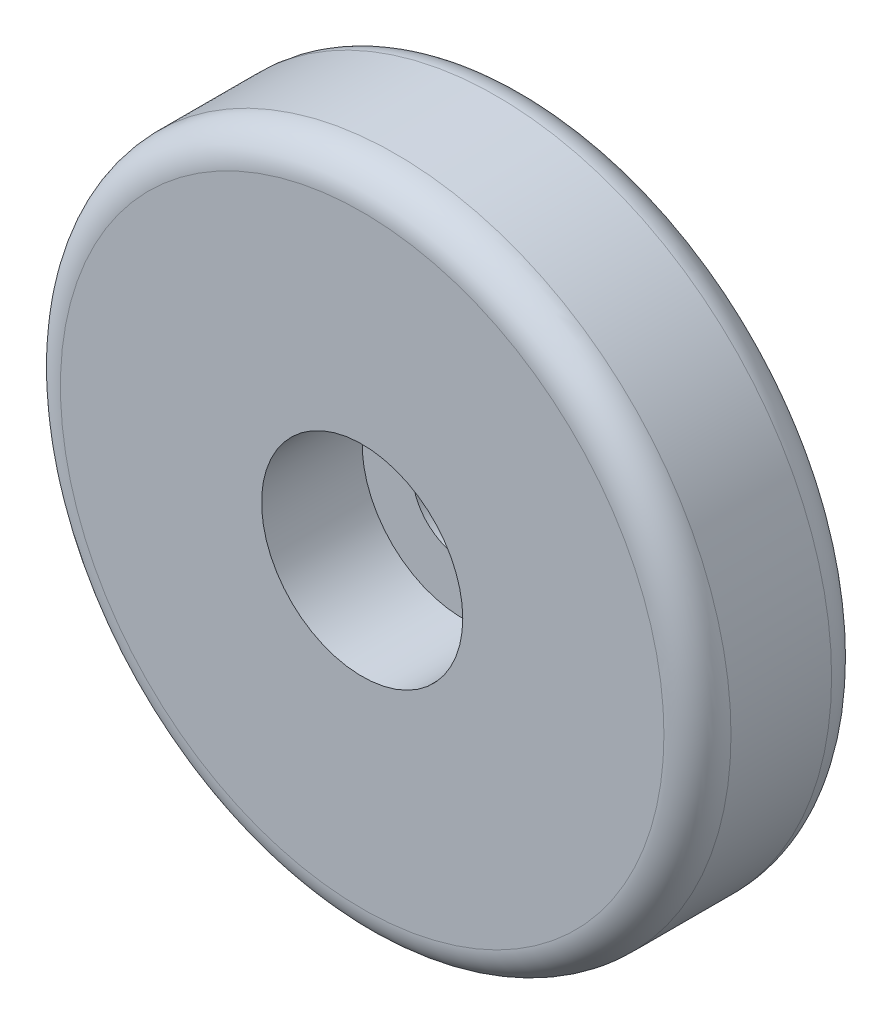
from build123d import *

# Parameters (mm, degrees)
ESQUISSE1_R             = 10
BOSS_EXTRU_1_DEPTH      = 5
ESQUISSE2_R             = 3
ENL_V_MAT_EXTRU_1_DEPTH = 3
ESQUISSE9_R             = 1.5
ENL_V_MAT_EXTRU_2_DEPTH = 3


with BuildPart() as part:
    # Esquisse1 → Boss.-Extru.1 (new body)
    with BuildSketch(Plane.XY):
        Circle(ESQUISSE1_R)
    extrude(amount=BOSS_EXTRU_1_DEPTH)

    # Esquisse2 → Enlèv. mat.-Extru.1 (cut)
    with BuildSketch(Plane.XY.offset(5)):
        Circle(ESQUISSE2_R)
    extrude(amount=-ENL_V_MAT_EXTRU_1_DEPTH, mode=Mode.SUBTRACT)

    # Esquisse3 → Enlèvement de matière-Révolution1 (revolve, cut)
    with BuildSketch(Plane(origin=(0, 0, 0), x_dir=(0, 0, -1), z_dir=(1, 0, 0)), mode=Mode.PRIVATE) as enl_vement_de_mati_re_r_volution1_sk:
        with BuildLine():
            Line((0, 10), (-1, 10))
            ThreePointArc((-1, 10), (-0.292893219, 9.707106781), (0, 9))
            Line((0, 9), (0, 10))
        make_face()
        with BuildLine():
            Line((-4, 10), (-5, 10))
            Line((-5, 10), (-5, 9))
            ThreePointArc((-5, 9), (-4.707106781, 9.707106781), (-4, 10))
        make_face()
    revolve(enl_vement_de_mati_re_r_volution1_sk.sketch.rotate(Axis((0, 0, 5), (0, 0, -1)), 90), axis=Axis((0, 0, 5), (0, 0, -1)), mode=Mode.SUBTRACT)

    # Esquisse9 → Enlèv. mat.-Extru.2 (cut)
    with BuildSketch(Plane(origin=(0, 0, 0), x_dir=(-1, 0, 0), z_dir=(0, 0, -1))):
        Circle(ESQUISSE9_R)
    extrude(amount=-ENL_V_MAT_EXTRU_2_DEPTH, mode=Mode.SUBTRACT)


solid = part.part
